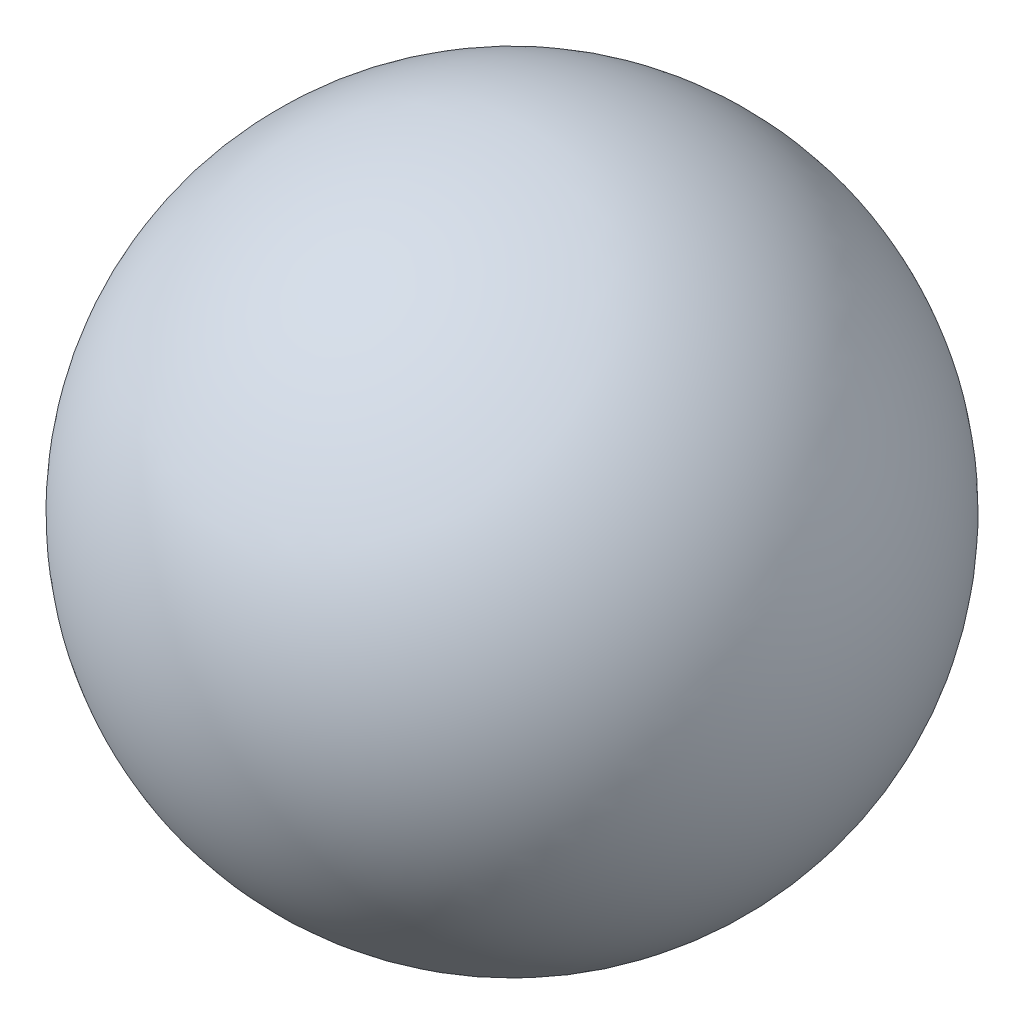
from build123d import *


with BuildPart() as part:
    # Sketch3 → Revolve-Thin1 (revolve)
    with BuildSketch(Plane(origin=(0, 0, 0), x_dir=(1, 0, 0), z_dir=(0, 1, 0))):
        with BuildLine():
            ThreePointArc((0, 127), (-127, 0), (0, -127))
            Line((0, -127), (0, -129.54))
            ThreePointArc((0, -129.54), (-129.54, 0), (0, 129.54))
            Line((0, 129.54), (0, 127))
        make_face()
    revolve(axis=Axis((0, 0, 127), (0, 0, -1)))


solid = part.part
